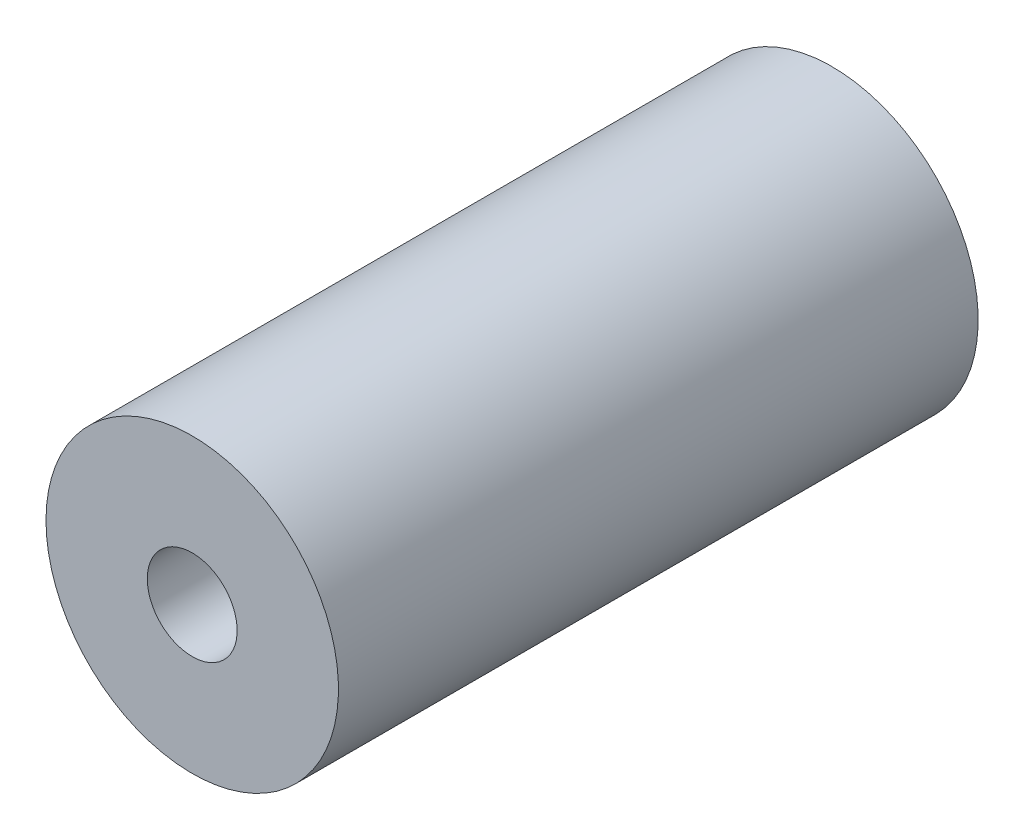
from build123d import *


with BuildPart() as part:
    # Sketch1 → Revolve1 (revolve)
    with BuildSketch(Plane.XZ, mode=Mode.PRIVATE) as revolve1_sk:
        Polygon((8, 0), (8, 35), (2.4585, 35), (2.4585, 20), (1.75, 19.574290251), (1.75, 0), align=None)
    revolve(revolve1_sk.sketch.rotate(Axis((0, 0, 35), (0, 0, -1)), 180), axis=Axis((0, 0, 35), (0, 0, -1)))


solid = part.part
